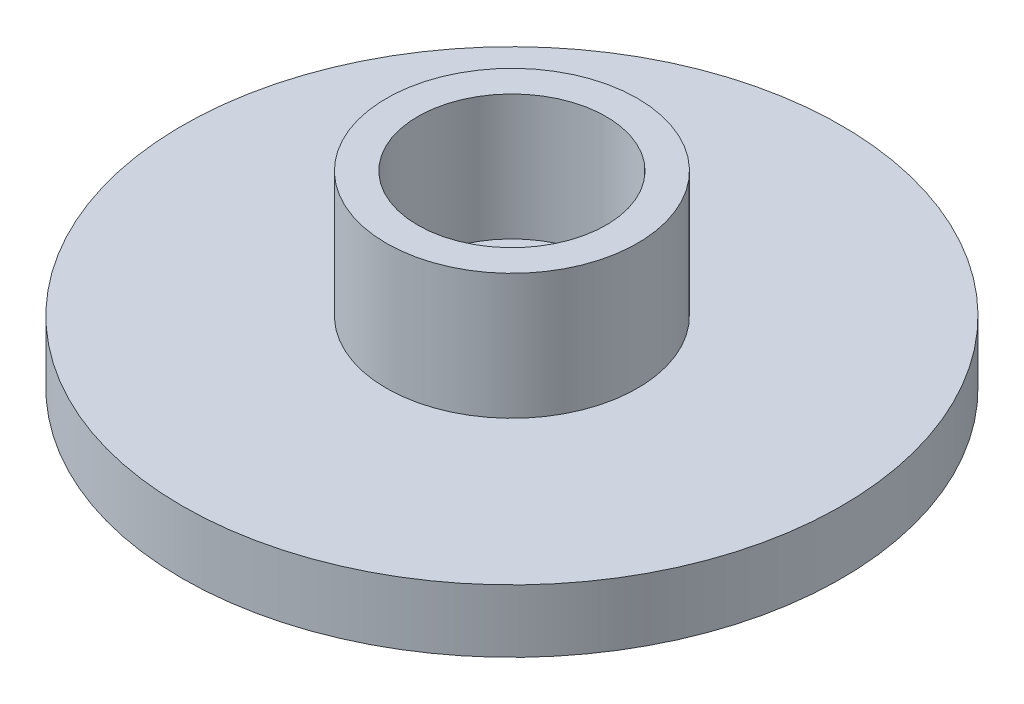
from build123d import *

# Parameters (mm, degrees)
SKETCH1_R           = 10.5
BOSS_EXTRUDE1_DEPTH = 2
SKETCH2_R           = 4
BOSS_EXTRUDE2_DEPTH = 4
SKETCH3_R           = 3
CUT_EXTRUDE1_DEPTH  = 4


with BuildPart() as part:
    # Sketch1 → Boss-Extrude1 (new body)
    with BuildSketch(Plane(origin=(0, 0, 0), x_dir=(1, 0, 0), z_dir=(0, 1, 0))):
        with Locations(Location((0, 0, 0), (0, 0, 270))):
            Circle(SKETCH1_R)
    extrude(amount=BOSS_EXTRUDE1_DEPTH)

    # Sketch2 → Boss-Extrude2 (add)
    with BuildSketch(Plane(origin=(0, 2, 0), x_dir=(1, 0, 0), z_dir=(0, 1, 0))):
        with Locations(Location((0, 0, 0), (0, 0, 270))):
            Circle(SKETCH2_R)
    extrude(amount=BOSS_EXTRUDE2_DEPTH)

    # Sketch3 → Cut-Extrude1 (cut)
    with BuildSketch(Plane(origin=(0, 6, 0), x_dir=(1, 0, 0), z_dir=(0, 1, 0))):
        with Locations(Location((0, 0, 0), (0, 0, 270))):
            Circle(SKETCH3_R)
    extrude(amount=-CUT_EXTRUDE1_DEPTH, mode=Mode.SUBTRACT)


solid = part.part
